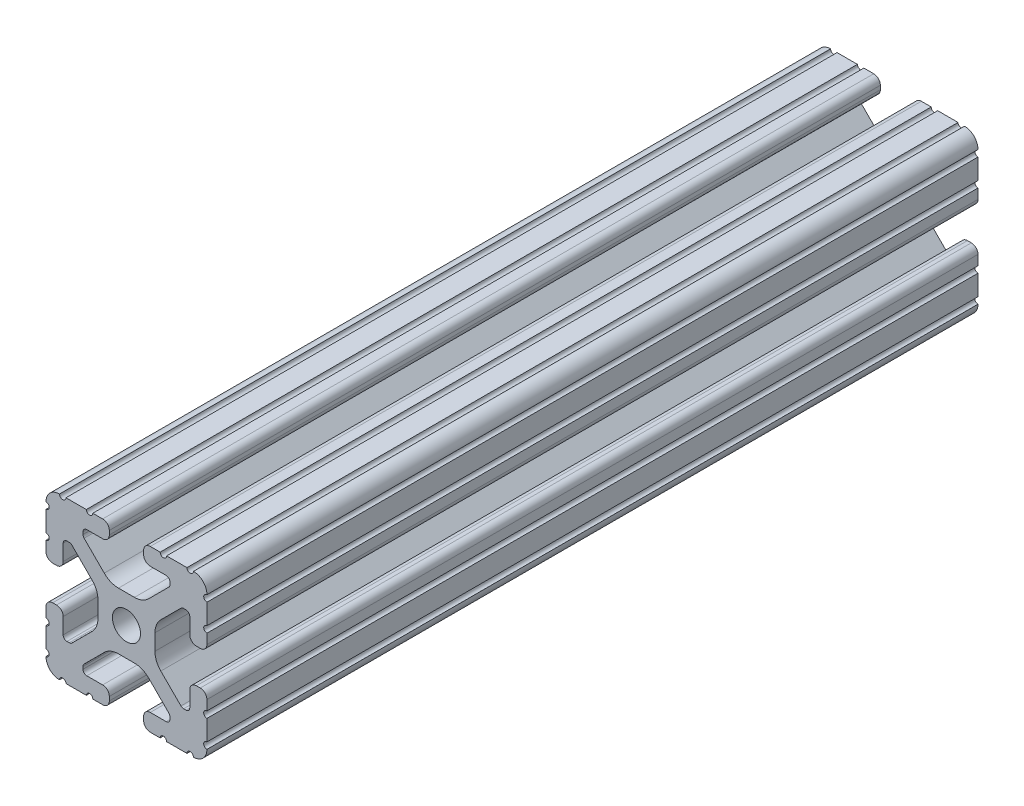
from build123d import *

# Parameters (mm, degrees)
SKETCH1_R           = 3.3274
BOSS_EXTRUDE1_DEPTH = 182.5625


with BuildPart() as part:
    # Sketch1 → Boss-Extrude1 (new body)
    with BuildSketch(Plane.XY):
        with BuildLine():
            Line((-14.097, 10.287), (-13.528918, 10.287))
            ThreePointArc((-13.528918, 10.287), (-13.188712428, 10.219328904), (-12.900300071, 10.026617928))
            Line((-12.900300071, 10.026617928), (-8.129198975, 5.255516832))
            ThreePointArc((-8.129198975, 5.255516832), (-7.09957176, 3.71457081), (-6.738014764, 1.896901043))
            Line((-6.738014764, 1.896901043), (-6.738014764, -1.896901043))
            ThreePointArc((-6.738014764, -1.896901043), (-7.09957176, -3.71457081), (-8.129198975, -5.255516832))
            Line((-8.129198975, -5.255516832), (-12.900300071, -10.026617928))
            ThreePointArc((-12.900300071, -10.026617928), (-13.188712428, -10.219328904), (-13.528918, -10.287))
            Line((-13.528918, -10.287), (-14.097, -10.287))
            ThreePointArc((-14.097, -10.287), (-14.725617928, -10.026617928), (-14.986, -9.398))
            Line((-14.986, -9.398), (-14.986, -5.6388))
            ThreePointArc((-14.986, -5.6388), (-15.447248241, -4.525248241), (-16.5608, -4.064))
            Line((-16.5608, -4.064), (-17.4752, -4.064))
            ThreePointArc((-17.4752, -4.064), (-18.588751759, -4.525248241), (-19.05, -5.6388))
            Line((-19.05, -5.6388), (-19.05, -7.9756))
            ThreePointArc((-19.05, -7.9756), (-18.288, -8.7376), (-19.05, -9.4996))
            Line((-19.05, -9.4996), (-19.05, -14.3256))
            ThreePointArc((-19.05, -14.3256), (-18.288, -15.0876), (-19.05, -15.8496))
            Line((-19.05, -15.8496), (-19.05, -15.875))
            ThreePointArc((-19.05, -15.875), (-18.12006403, -18.12006403), (-15.875, -19.05))
            Line((-15.875, -19.05), (-15.8496, -19.05))
            ThreePointArc((-15.8496, -19.05), (-15.0876, -18.288), (-14.3256, -19.05))
            Line((-14.3256, -19.05), (-9.4996, -19.05))
            ThreePointArc((-9.4996, -19.05), (-8.7376, -18.288), (-7.9756, -19.05))
            Line((-7.9756, -19.05), (-5.6388, -19.05))
            ThreePointArc((-5.6388, -19.05), (-4.525248241, -18.588751759), (-4.064, -17.4752))
            Line((-4.064, -17.4752), (-4.064, -16.5608))
            ThreePointArc((-4.064, -16.5608), (-4.525248241, -15.447248241), (-5.6388, -14.986))
            Line((-5.6388, -14.986), (-9.398, -14.986))
            ThreePointArc((-9.398, -14.986), (-10.026617928, -14.725617928), (-10.287, -14.097))
            Line((-10.287, -14.097), (-10.287, -13.528918))
            ThreePointArc((-10.287, -13.528918), (-10.219328904, -13.188712428), (-10.026617928, -12.900300071))
            Line((-10.026617928, -12.900300071), (-5.255516832, -8.129198975))
            ThreePointArc((-5.255516832, -8.129198975), (-3.71457081, -7.09957176), (-1.896901043, -6.738014764))
            Line((-1.896901043, -6.738014764), (1.896901043, -6.738014764))
            ThreePointArc((1.896901043, -6.738014764), (3.71457081, -7.09957176), (5.255516832, -8.129198975))
            Line((5.255516832, -8.129198975), (10.026617928, -12.900300071))
            ThreePointArc((10.026617928, -12.900300071), (10.219328904, -13.188712428), (10.287, -13.528918))
            Line((10.287, -13.528918), (10.287, -14.097))
            ThreePointArc((10.287, -14.097), (10.026617928, -14.725617928), (9.398, -14.986))
            Line((9.398, -14.986), (5.6388, -14.986))
            ThreePointArc((5.6388, -14.986), (4.525248241, -15.447248241), (4.064, -16.5608))
            Line((4.064, -16.5608), (4.064, -17.4752))
            ThreePointArc((4.064, -17.4752), (4.525248241, -18.588751759), (5.6388, -19.05))
            Line((5.6388, -19.05), (7.9756, -19.05))
            ThreePointArc((7.9756, -19.05), (8.7376, -18.288), (9.4996, -19.05))
            Line((9.4996, -19.05), (14.3256, -19.05))
            ThreePointArc((14.3256, -19.05), (15.0876, -18.288), (15.8496, -19.05))
            Line((15.8496, -19.05), (15.875, -19.05))
            ThreePointArc((15.875, -19.05), (18.12006403, -18.12006403), (19.05, -15.875))
            Line((19.05, -15.875), (19.05, -15.8496))
            ThreePointArc((19.05, -15.8496), (18.288, -15.0876), (19.05, -14.3256))
            Line((19.05, -14.3256), (19.05, -9.4996))
            ThreePointArc((19.05, -9.4996), (18.288, -8.7376), (19.05, -7.9756))
            Line((19.05, -7.9756), (19.05, -5.6388))
            ThreePointArc((19.05, -5.6388), (18.588751759, -4.525248241), (17.4752, -4.064))
            Line((17.4752, -4.064), (16.5608, -4.064))
            ThreePointArc((16.5608, -4.064), (15.447248241, -4.525248241), (14.986, -5.6388))
            Line((14.986, -5.6388), (14.986, -9.398))
            ThreePointArc((14.986, -9.398), (14.725617928, -10.026617928), (14.097, -10.287))
            Line((14.097, -10.287), (13.528918, -10.287))
            ThreePointArc((13.528918, -10.287), (13.188712428, -10.219328904), (12.900300071, -10.026617928))
            Line((12.900300071, -10.026617928), (8.129198975, -5.255516832))
            ThreePointArc((8.129198975, -5.255516832), (7.09957176, -3.71457081), (6.738014764, -1.896901043))
            Line((6.738014764, -1.896901043), (6.738014764, 1.896901043))
            ThreePointArc((6.738014764, 1.896901043), (7.09957176, 3.71457081), (8.129198975, 5.255516832))
            Line((8.129198975, 5.255516832), (12.900300071, 10.026617928))
            ThreePointArc((12.900300071, 10.026617928), (13.188712428, 10.219328904), (13.528918, 10.287))
            Line((13.528918, 10.287), (14.097, 10.287))
            ThreePointArc((14.097, 10.287), (14.725617928, 10.026617928), (14.986, 9.398))
            Line((14.986, 9.398), (14.986, 5.6388))
            ThreePointArc((14.986, 5.6388), (15.447248241, 4.525248241), (16.5608, 4.064))
            Line((16.5608, 4.064), (17.4752, 4.064))
            ThreePointArc((17.4752, 4.064), (18.588751759, 4.525248241), (19.05, 5.6388))
            Line((19.05, 5.6388), (19.05, 7.9756))
            ThreePointArc((19.05, 7.9756), (18.288, 8.7376), (19.05, 9.4996))
            Line((19.05, 9.4996), (19.05, 14.3256))
            ThreePointArc((19.05, 14.3256), (18.288, 15.0876), (19.05, 15.8496))
            Line((19.05, 15.8496), (19.05, 15.875))
            ThreePointArc((19.05, 15.875), (18.12006403, 18.12006403), (15.875, 19.05))
            Line((15.875, 19.05), (15.8496, 19.05))
            ThreePointArc((15.8496, 19.05), (15.0876, 18.288), (14.3256, 19.05))
            Line((14.3256, 19.05), (9.4996, 19.05))
            ThreePointArc((9.4996, 19.05), (8.7376, 18.288), (7.9756, 19.05))
            Line((7.9756, 19.05), (5.6388, 19.05))
            ThreePointArc((5.6388, 19.05), (4.525248241, 18.588751759), (4.064, 17.4752))
            Line((4.064, 17.4752), (4.064, 16.5608))
            ThreePointArc((4.064, 16.5608), (4.525248241, 15.447248241), (5.6388, 14.986))
            Line((5.6388, 14.986), (9.398, 14.986))
            ThreePointArc((9.398, 14.986), (10.026617928, 14.725617928), (10.287, 14.097))
            Line((10.287, 14.097), (10.287, 13.528918))
            ThreePointArc((10.287, 13.528918), (10.219328904, 13.188712428), (10.026617928, 12.900300071))
            Line((10.026617928, 12.900300071), (5.255516832, 8.129198975))
            ThreePointArc((5.255516832, 8.129198975), (3.71457081, 7.09957176), (1.896901043, 6.738014764))
            Line((1.896901043, 6.738014764), (-1.896901043, 6.738014764))
            ThreePointArc((-1.896901043, 6.738014764), (-3.71457081, 7.09957176), (-5.255516832, 8.129198975))
            Line((-5.255516832, 8.129198975), (-10.026617928, 12.900300071))
            ThreePointArc((-10.026617928, 12.900300071), (-10.219328904, 13.188712428), (-10.287, 13.528918))
            Line((-10.287, 13.528918), (-10.287, 14.097))
            ThreePointArc((-10.287, 14.097), (-10.026617928, 14.725617928), (-9.398, 14.986))
            Line((-9.398, 14.986), (-5.6388, 14.986))
            ThreePointArc((-5.6388, 14.986), (-4.525248241, 15.447248241), (-4.064, 16.5608))
            Line((-4.064, 16.5608), (-4.064, 17.4752))
            ThreePointArc((-4.064, 17.4752), (-4.525248241, 18.588751759), (-5.6388, 19.05))
            Line((-5.6388, 19.05), (-7.9756, 19.05))
            ThreePointArc((-7.9756, 19.05), (-8.7376, 18.288), (-9.4996, 19.05))
            Line((-9.4996, 19.05), (-14.3256, 19.05))
            ThreePointArc((-14.3256, 19.05), (-15.0876, 18.288), (-15.8496, 19.05))
            Line((-15.8496, 19.05), (-15.875, 19.05))
            ThreePointArc((-15.875, 19.05), (-18.12006403, 18.12006403), (-19.05, 15.875))
            Line((-19.05, 15.875), (-19.05, 15.8496))
            ThreePointArc((-19.05, 15.8496), (-18.288, 15.0876), (-19.05, 14.3256))
            Line((-19.05, 14.3256), (-19.05, 9.4996))
            ThreePointArc((-19.05, 9.4996), (-18.288, 8.7376), (-19.05, 7.9756))
            Line((-19.05, 7.9756), (-19.05, 5.6388))
            ThreePointArc((-19.05, 5.6388), (-18.588751759, 4.525248241), (-17.4752, 4.064))
            Line((-17.4752, 4.064), (-16.5608, 4.064))
            ThreePointArc((-16.5608, 4.064), (-15.447248241, 4.525248241), (-14.986, 5.6388))
            Line((-14.986, 5.6388), (-14.986, 9.398))
            ThreePointArc((-14.986, 9.398), (-14.725617928, 10.026617928), (-14.097, 10.287))
        make_face()
        Circle(SKETCH1_R, mode=Mode.SUBTRACT)
    extrude(amount=BOSS_EXTRUDE1_DEPTH)


solid = part.part
